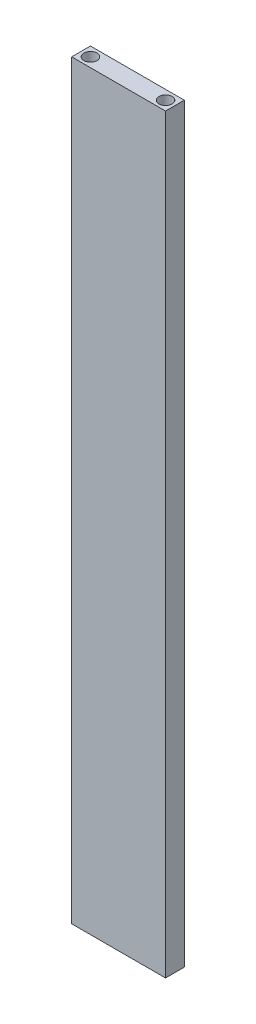
from build123d import *

# Parameters (mm, degrees)
SKETCH1_W           = 20
SKETCH1_H           = 4
BOSS_EXTRUDE1_DEPTH = 160
CUT_EXTRUDE1_REACH  = 163.295
SKETCH2_R           = 1.4


with BuildPart() as part:
    # Sketch1 → Boss-Extrude1 (new body)
    with BuildSketch(Plane(origin=(0, 0, 0), x_dir=(1, 0, 0), z_dir=(0, 1, 0))):
        with Locations((-10, -2)):
            Rectangle(SKETCH1_W, SKETCH1_H)
    extrude(amount=BOSS_EXTRUDE1_DEPTH)

    # Sketch2 → Cut-Extrude1 (cut, up to next)
    with BuildSketch(Plane(origin=(0, 0, 0), x_dir=(-1, 0, 0), z_dir=(0, -1, 0)), mode=Mode.PRIVATE) as cut_extrude1_sk1:
        with Locations(Location((18, -2, 0), (0, 0, 90))):
            Circle(SKETCH2_R)
    cut_extrude1_tool1 = extrude(cut_extrude1_sk1.sketch, amount=-CUT_EXTRUDE1_REACH, mode=Mode.PRIVATE) & part.part
    # Sketch2 → Cut-Extrude1 (cut, up to next)
    with BuildSketch(Plane(origin=(0, 0, 0), x_dir=(-1, 0, 0), z_dir=(0, -1, 0)), mode=Mode.PRIVATE) as cut_extrude1_sk2:
        with Locations(Location((2, -2, 0), (0, 0, 90))):
            Circle(SKETCH2_R)
    cut_extrude1_tool2 = extrude(cut_extrude1_sk2.sketch, amount=-CUT_EXTRUDE1_REACH, mode=Mode.PRIVATE) & part.part
    add(cut_extrude1_tool1.solids().sort_by_distance((-18, 0, 2))[0], mode=Mode.SUBTRACT)
    add(cut_extrude1_tool2.solids().sort_by_distance((-2, 0, 2))[0], mode=Mode.SUBTRACT)


solid = part.part
